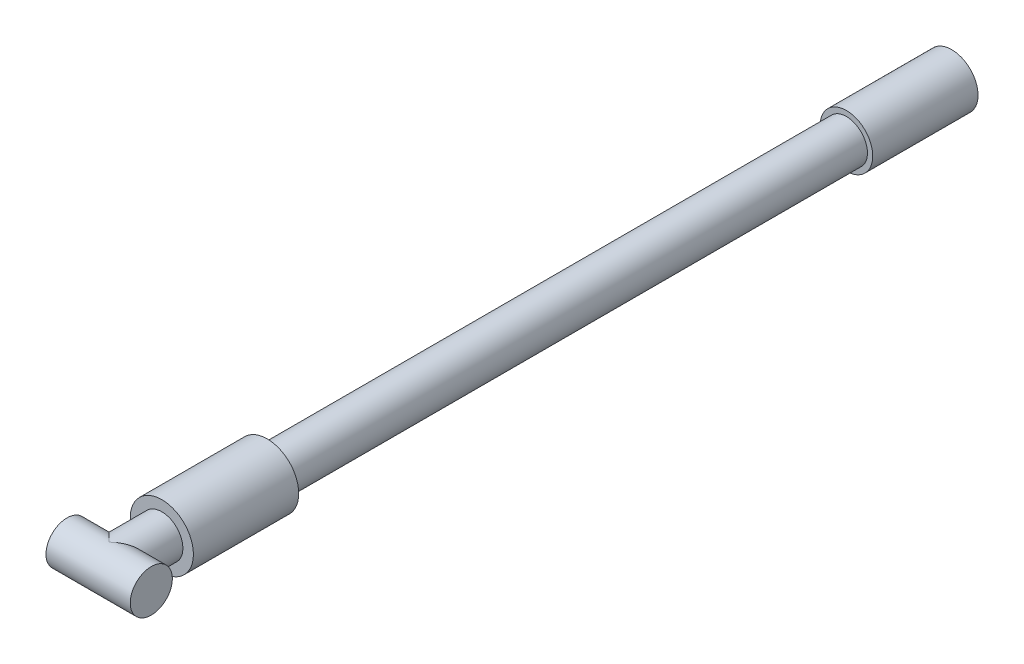
from build123d import *

# Parameters (mm, degrees)
SKETCH1_R                = 4
BOSS_EXTRUDE1_DEPTH      = 150
SKETCH2_R                = 5
BOSS_EXTRUDE2_DEPTH      = 20
SKETCH3_R                = 6
BOSS_EXTRUDE3_DEPTH      = 20
BOSS_EXTRUDE6_START      = 10
SKETCH4_R                = 4
BOSS_EXTRUDE6_DEPTH      = 10
BOSS_EXTRUDE7_DEPTH      = 8
BOSS_EXTRUDE7_DEPTH_BACK = 8
SKETCH6_R                = 4


with BuildPart() as part:
    # Sketch1 → Boss-Extrude1 (new body)
    with BuildSketch(Plane.XY):
        Circle(SKETCH1_R)
    extrude(amount=-BOSS_EXTRUDE1_DEPTH)

    # Sketch2 → Boss-Extrude2 (add)
    with BuildSketch(Plane(origin=(0, 0, -150), x_dir=(-1, 0, 0), z_dir=(0, 0, -1))):
        Circle(SKETCH2_R)
    extrude(amount=-BOSS_EXTRUDE2_DEPTH)

    # Sketch3 → Boss-Extrude3 (add)
    with BuildSketch(Plane.XY):
        Circle(SKETCH3_R)
    extrude(amount=-BOSS_EXTRUDE3_DEPTH)

    # Sketch4 → Boss-Extrude6 (add)
    with BuildSketch(Plane.XY.offset(BOSS_EXTRUDE6_START)):
        Circle(SKETCH4_R)
    extrude(amount=-BOSS_EXTRUDE6_DEPTH)

    # Sketch6 → Boss-Extrude7 (add, two sides: drawn at the far end of the back side and taken through both)
    with BuildSketch(Plane(origin=(0, 0, 0), x_dir=(0, 0, -1), z_dir=(1, 0, 0)).offset(-BOSS_EXTRUDE7_DEPTH_BACK)):
        with Locations((-10, 0)):
            Circle(SKETCH6_R)
    extrude(amount=BOSS_EXTRUDE7_DEPTH + BOSS_EXTRUDE7_DEPTH_BACK)


solid = part.part
